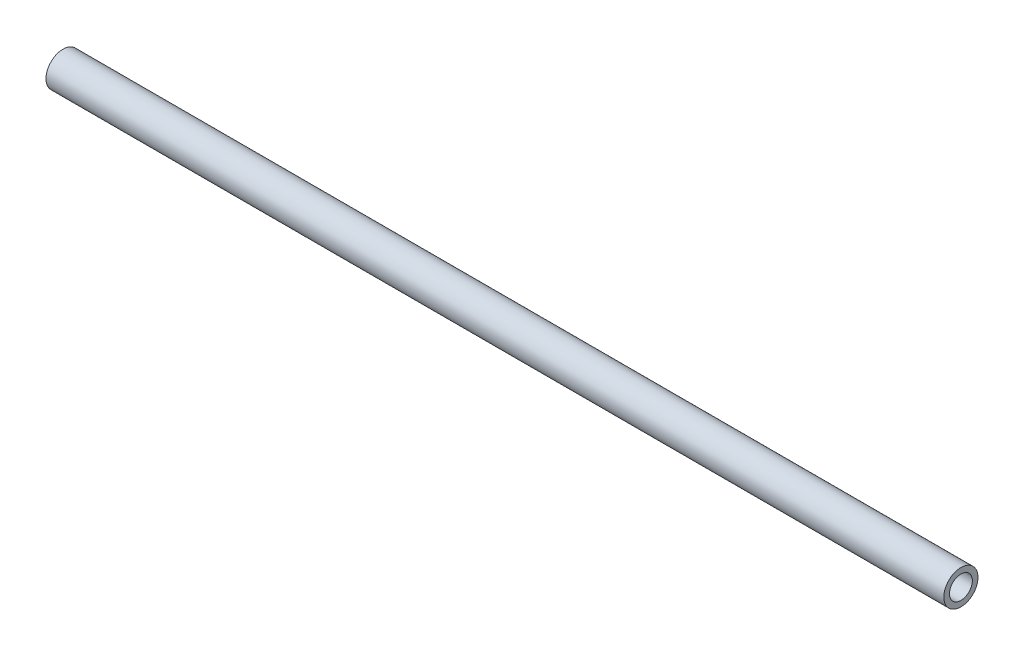
from build123d import *

# Parameters (mm, degrees)
SKETCH1_R           = 1.4986
SKETCH1_R_2         = 1.0033
BOSS_EXTRUDE1_DEPTH = 39.37


with BuildPart() as part:
    # Sketch1 → Boss-Extrude1 (new, symmetric)
    with BuildSketch(Plane(origin=(0, 0, 0), x_dir=(0, 0, -1), z_dir=(1, 0, 0))):
        Circle(SKETCH1_R)
        Circle(SKETCH1_R_2, mode=Mode.SUBTRACT)
    extrude(amount=BOSS_EXTRUDE1_DEPTH, both=True)


solid = part.part
